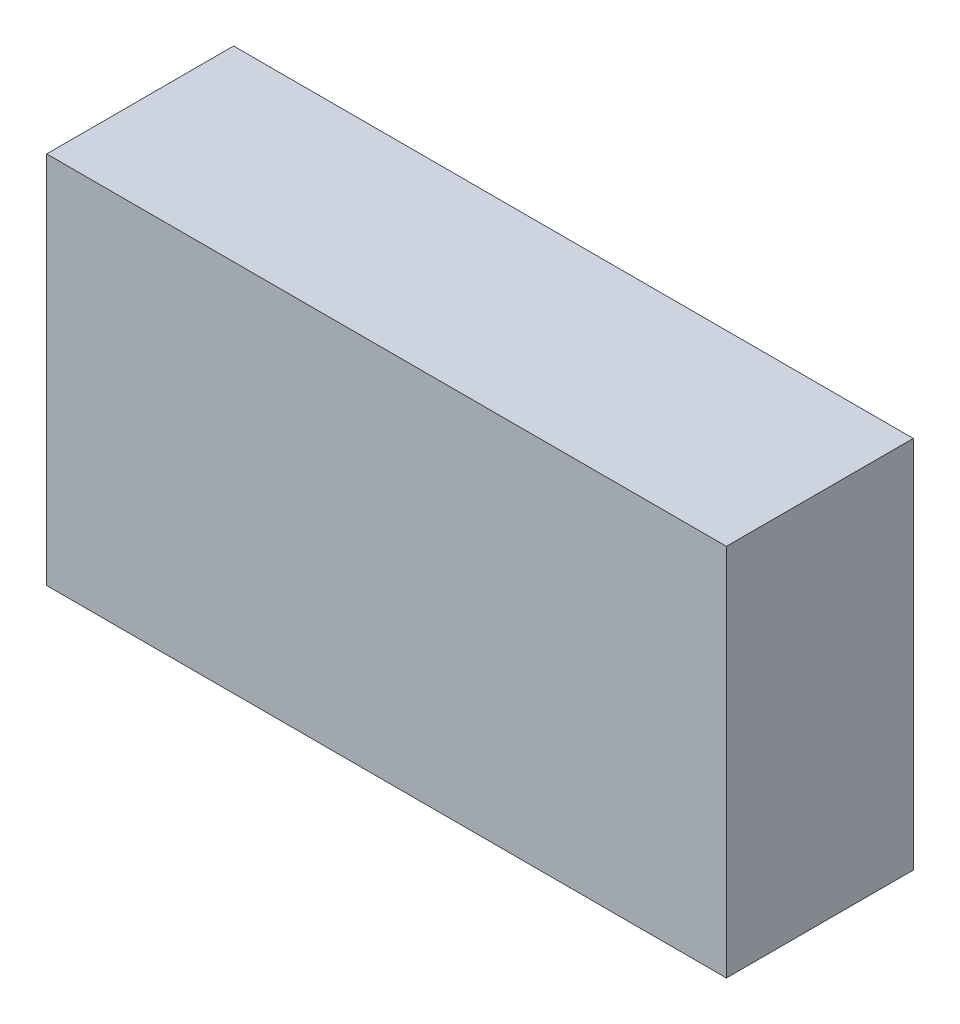
from build123d import *

# Parameters (mm, degrees)
SKETCH1_W           = 40
SKETCH1_H           = 22
BOSS_EXTRUDE1_DEPTH = 11


with BuildPart() as part:
    # Sketch1 → Boss-Extrude1 (new body)
    with BuildSketch(Plane.XY):
        with Locations((12, 17)):
            Rectangle(SKETCH1_W, SKETCH1_H)
    extrude(amount=BOSS_EXTRUDE1_DEPTH)


solid = part.part
